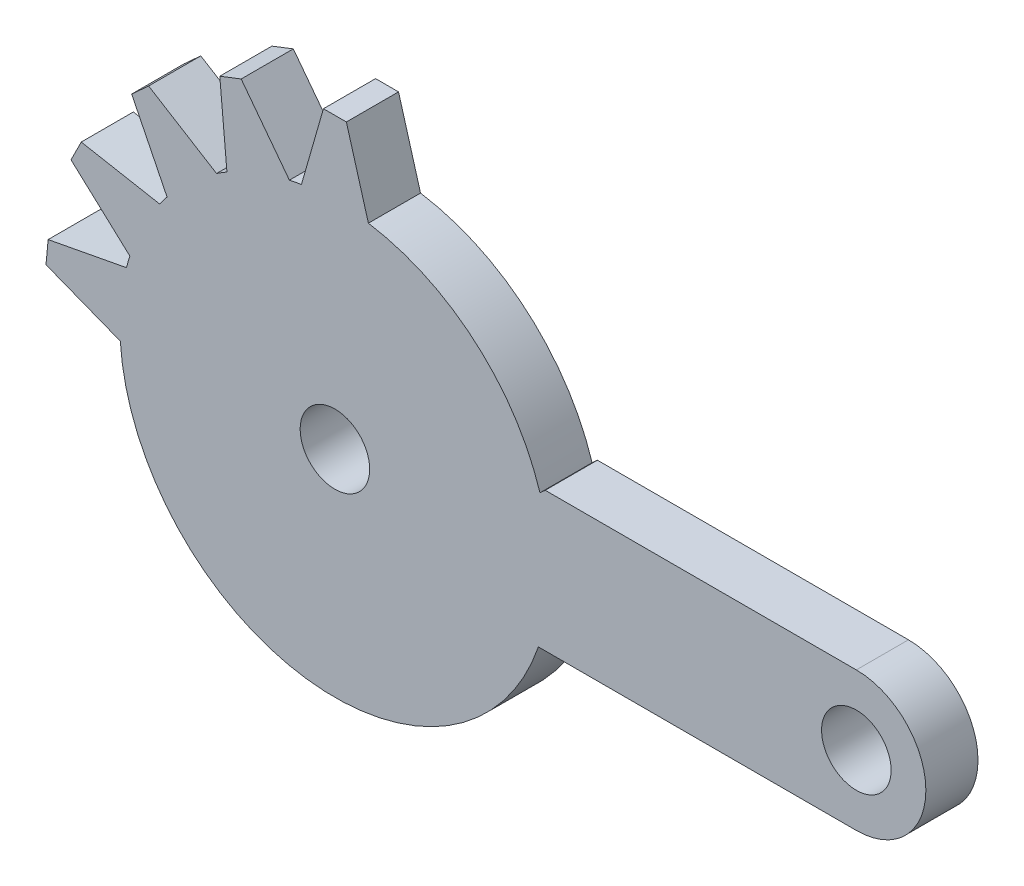
from build123d import *
from build123d.topology import SkipClean

# Parameters (mm, degrees)
SKETCH_1_R      = 12.371827661
SKETCH_1_R_2    = 2
SKETCH_1_R_3    = 4
EXTRUDE_2_DEPTH = 3
EXTRUDE_START   = 4.5
SKETCH_2_R      = 3.472144909
SKETCH_2_R_2    = 2
EXTRUDE_5_DEPTH = 4.5


with BuildPart() as part:
    # ｽｹｯﾁ1 → ﾎﾞｽ - 押し出し2 (new body)
    # profile 1 of 10: a face of its own
    with BuildSketch(Plane.XY):
        with BuildLine():
            ThreePointArc((-12.346524216, -0.790859961), (-12.319051626, 1.141528242), (-11.990981042, 3.046061939))
            Line((-11.990981042, 3.046061939), (-16.499913731, 2.191691895))
            Line((-16.499913731, 2.191691895), (-16.621693674, 0.877477017))
            Line((-16.621693674, 0.877477017), (-12.346524216, -0.790859961))
        make_face()
    # profile 2 of 10: a face of its own
    with BuildSketch(Plane.XY):
        with BuildLine():
            ThreePointArc((-11.798482531, 3.722624028), (-11.074805969, 5.51459812), (-10.080892335, 7.172010138))
            Line((-10.080892335, 7.172010138), (-14.59398091, 8.004148156))
            Line((-14.59398091, 8.004148156), (-15.182286497, 6.822671267))
            Line((-15.182286497, 6.822671267), (-11.798482531, 3.722624028))
        make_face()
    # profile 3 of 10: a face of its own
    with BuildSketch(Plane.XY):
        with BuildLine():
            ThreePointArc((-9.656990403, 7.733347015), (-8.334846399, 9.142890964), (-6.809323258, 10.329338626))
            Line((-6.809323258, 10.329338626), (-10.717050099, 12.735599855))
            Line((-10.717050099, 12.735599855), (-11.692427401, 11.846425958))
            Line((-11.692427401, 11.846425958), (-9.656990403, 7.733347015))
        make_face()
    # profile 4 of 10: a face of its own
    with BuildSketch(Plane.XY):
        with BuildLine():
            ThreePointArc((-6.211268209, 10.699638635), (-4.469219638, 11.536385721), (-2.618117343, 12.091632696))
            Line((-2.618117343, 12.091632696), (-5.392722287, 15.747038224))
            Line((-5.392722287, 15.747038224), (-6.623441194, 15.27025518))
            Line((-6.623441194, 15.27025518), (-6.211268209, 10.699638635))
        make_face()
    # profile 5 of 10: a face of its own
    with BuildSketch(Plane.XY):
        with BuildLine():
            Line((0.659922552, 16.631751824), (-0.659922552, 16.631751824))
            Line((-0.659922552, 16.631751824), (-1.926679827, 12.220884769))
            ThreePointArc((-1.926679827, 12.220884769), (0, 12.371827661), (1.926679827, 12.220884769))
            Line((1.926679827, 12.220884769), (0.659922552, 16.631751824))
        make_face()
    # profile 6 of 10: a face of its own
    with BuildSketch(Plane.XY):
        with BuildLine():
            Line((12.101247567, 4), (11.798482531, 3.722624028))
            ThreePointArc((11.798482531, 3.722624028), (11.899541098, 3.38571135), (11.990981042, 3.046061939))
            Line((11.990981042, 3.046061939), (16.499913731, 2.191691895))
            Line((16.499913731, 2.191691895), (16.621693674, 0.877477017))
            Line((16.621693674, 0.877477017), (12.346524216, -0.790859961))
            ThreePointArc((12.346524216, -0.790859961), (12.319051626, -1.141528242), (12.281621315, -1.491273804))
            Line((12.281621315, -1.491273804), (16.177441774, -3.916764501))
            Line((16.177441774, -3.916764501), (16.153759232, -4))
            Line((16.153759232, -4), (30, -4))
            ThreePointArc((30, -4), (26, 0), (30, 4))
            Line((30, 4), (12.101247567, 4))
        make_face()
    # profile 7 of 10: a face of its own
    with BuildSketch(Plane.XY):
        with BuildLine():
            Line((16.499913731, 2.191691895), (11.990981042, 3.046061939))
            ThreePointArc((11.990981042, 3.046061939), (12.276246793, 1.534889042), (12.371827661, 0))
            ThreePointArc((12.371827661, 0), (12.365500182, -0.395632324), (12.346524216, -0.790859961))
            Line((12.346524216, -0.790859961), (16.621693674, 0.877477017))
            Line((16.621693674, 0.877477017), (16.499913731, 2.191691895))
        make_face()
    # profile 8 of 10: a face of its own
    with BuildSketch(Plane.XY):
        Circle(SKETCH_1_R)
        Circle(SKETCH_1_R_2, mode=Mode.SUBTRACT)
    # profile 9 of 10: a face of its own
    with BuildSketch(Plane.XY):
        with BuildLine():
            Line((11.707353231, -4), (16.153759232, -4))
            Line((16.153759232, -4), (16.177441774, -3.916764501))
            Line((16.177441774, -3.916764501), (12.281621315, -1.491273804))
            ThreePointArc((12.281621315, -1.491273804), (12.059898496, -2.760610069), (11.707353231, -4))
        make_face()
    # profile 10 of 10: a face of its own
    with BuildSketch(Plane.XY):
        with Locations((30, 0)):
            Circle(SKETCH_1_R_3)
        with Locations((30, 0)):
            Circle(SKETCH_1_R_2, mode=Mode.SUBTRACT)
    extrude(amount=EXTRUDE_2_DEPTH)

    # ｽｹｯﾁ2 → ﾎﾞｽ - 押し出し5 (add)
    with SkipClean():  # the faces are left unmerged after this step: merging them gives an invalid solid
        with BuildSketch(Plane(origin=(0, 0, 0), x_dir=(-1, 0, 0), z_dir=(0, 0, -1)).offset(EXTRUDE_START)):
            with Locations(Location((0, 0, 0), (0, 0, 180))):
                Circle(SKETCH_2_R)
            Circle(SKETCH_2_R_2, mode=Mode.SUBTRACT)
        extrude(amount=-EXTRUDE_5_DEPTH)


solid = part.part
